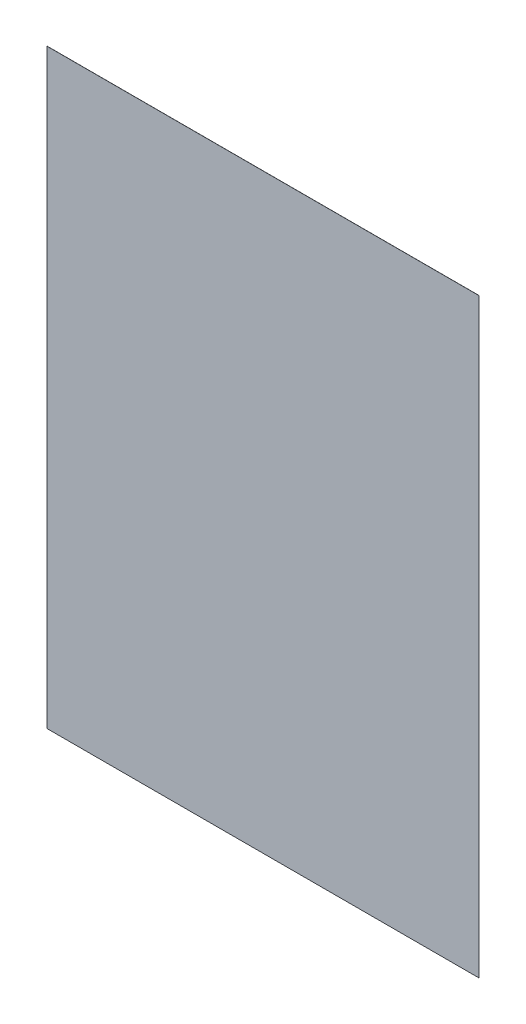
from build123d import *

# Parameters (mm, degrees)
SKETCH1_W           = 1280
SKETCH1_H           = 1750
BOSS_EXTRUDE1_DEPTH = 0.3556


with BuildPart() as part:
    # Sketch1 → Boss-Extrude1 (new body)
    with BuildSketch(Plane.XY):
        Rectangle(SKETCH1_W, SKETCH1_H)
    extrude(amount=BOSS_EXTRUDE1_DEPTH)


solid = part.part
